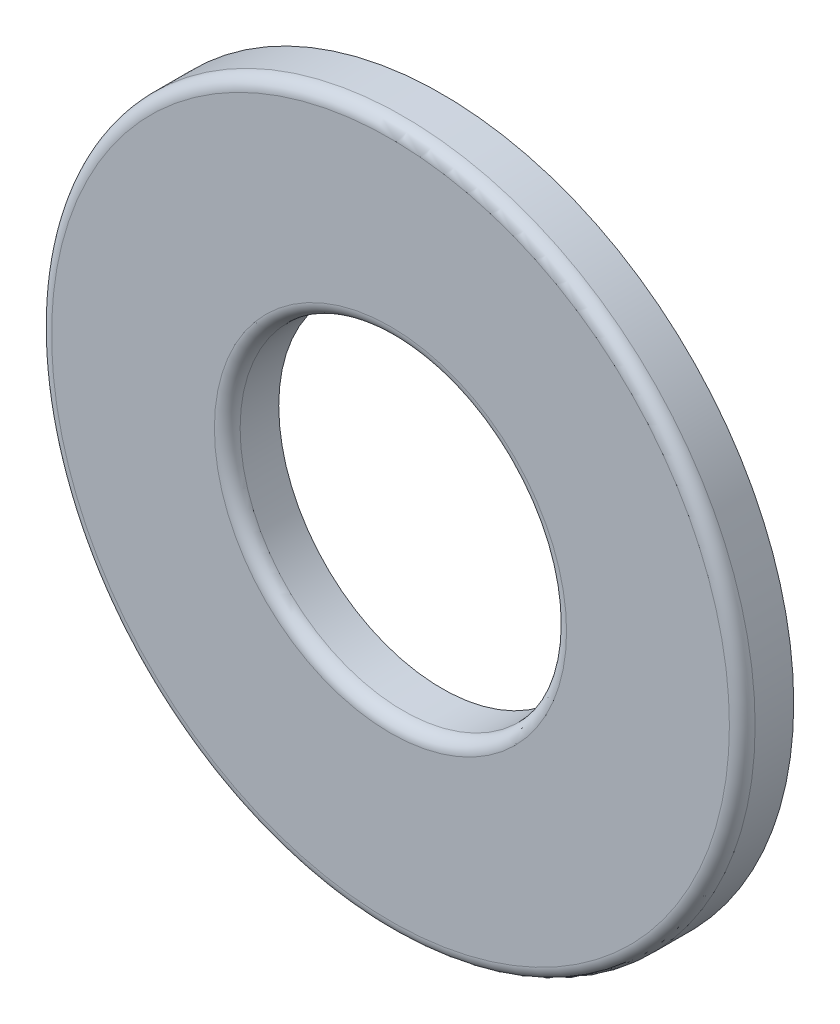
from build123d import *

# Parameters (mm, degrees)
BOSS_EXTRUDE1_DEPTH      = 0.4064
BOSS_EXTRUDE1_DEPTH_BACK = 0.4064
SKETCH3_R                = 5.55625
SKETCH3_R_2              = 2.5781
FILLET1_R                = 0.2032


with BuildPart() as part:
    # Sketch3 → Boss-Extrude1 (new, two sides: drawn at the far end of the back side and taken through both)
    with BuildSketch(Plane.XY.offset(-BOSS_EXTRUDE1_DEPTH_BACK)):
        Circle(SKETCH3_R)
        Circle(SKETCH3_R_2, mode=Mode.SUBTRACT)
    extrude(amount=BOSS_EXTRUDE1_DEPTH + BOSS_EXTRUDE1_DEPTH_BACK)

    # Fillet1
    fillet1_edges = [part.edges().sort_by_distance(p)[0] for p in [
        (-5.55625, 0, 0.4064),
        (-2.5781, 0, 0.4064),
    ]]
    fillet(fillet1_edges, radius=FILLET1_R)


solid = part.part
